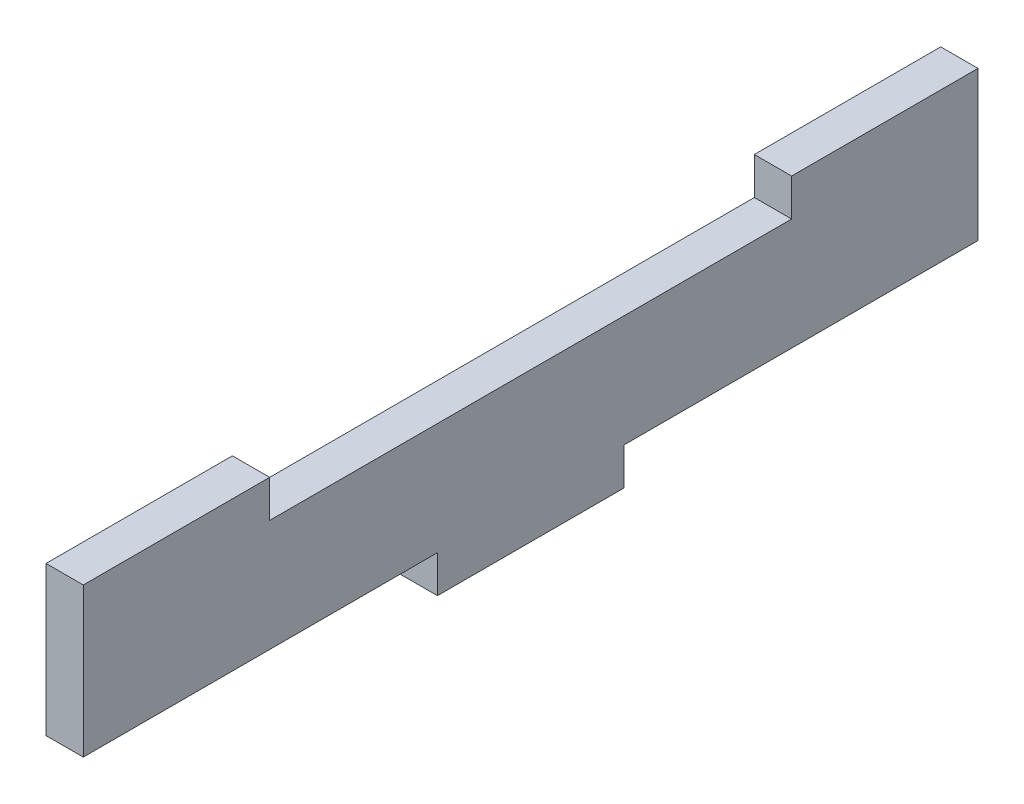
from build123d import *

# Parameters (mm, degrees)
EXTRUDE_1_DEPTH = 5


with BuildPart() as part:
    # 草图1 → 凸台-拉伸1 (new body)
    with BuildSketch(Plane(origin=(0, 0, 0), x_dir=(0, 0, -1), z_dir=(1, 0, 0))):
        Polygon((-47.5, 0), (0, 0), (0, 15), (0, 20), (-25, 20), (-25, 15), (-95, 15), (-95, 20), (-120, 20), (-120, 15), (-120, 0), (-72.5, 0), (-72.5, -5), (-47.5, -5), align=None)
    extrude(amount=EXTRUDE_1_DEPTH)


solid = part.part
